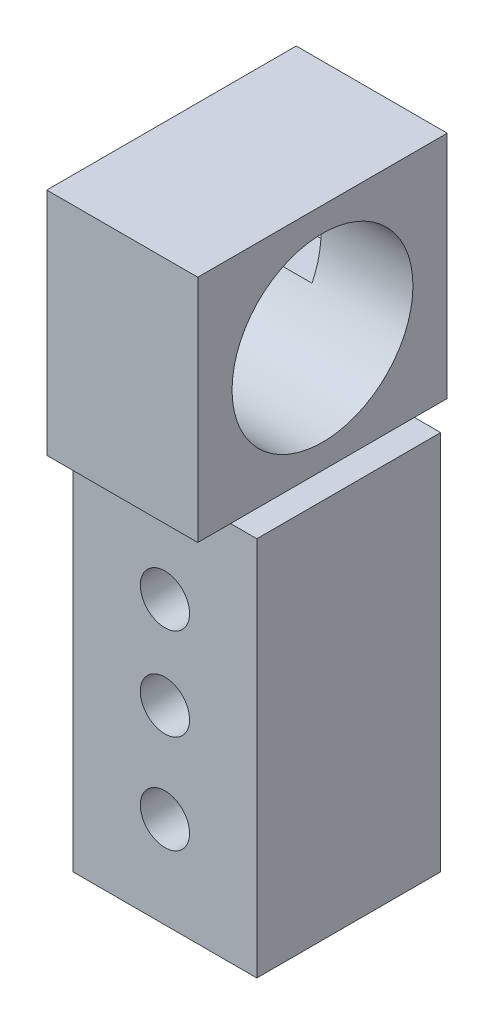
from build123d import *

# Parameters (mm, degrees)
SKETCH1_W           = 35.56
SKETCH1_H           = 35.56
BOSS_EXTRUDE1_DEPTH = 73.5965
SKETCH2_R           = 4.7625
CUT_EXTRUDE1_DEPTH  = 84.648591215
SKETCH3_W           = 25.4
SKETCH3_H           = 35.56
BOSS_EXTRUDE2_DEPTH = 44.45
SKETCH5_W           = 25.4
SKETCH5_H           = 44.45
BOSS_EXTRUDE3_DEPTH = 6.35
SKETCH6_W           = 25.4
SKETCH6_H           = 44.45
BOSS_EXTRUDE4_DEPTH = 6.35
SKETCH4_R           = 17.500000052
CUT_EXTRUDE2_DEPTH  = 84.232998938
SKETCH8_W           = 11.185009969
SKETCH8_H           = 15.24
CUT_EXTRUDE3_DEPTH  = 7.62
SKETCH9_W           = 48.26
SKETCH9_H           = 44.45
BOSS_EXTRUDE6_DEPTH = 3.81
SKETCH12_W          = 8.37609249
SKETCH12_H          = 15.24
CUT_EXTRUDE5_DEPTH  = 3.81
SKETCH13_R          = 5.588
CUT_EXTRUDE6_DEPTH  = 3.81
SKETCH14_R          = 1.5
CUT_EXTRUDE7_DEPTH  = 3.81


with BuildPart() as part:
    # Sketch1 → Boss-Extrude1 (new body)
    with BuildSketch(Plane(origin=(0, 0, 0), x_dir=(1, 0, 0), z_dir=(0, 1, 0))):
        Rectangle(SKETCH1_W, SKETCH1_H)
    extrude(amount=-BOSS_EXTRUDE1_DEPTH)

    # Sketch2 → Cut-Extrude1 (cut, through all)
    with BuildSketch(Plane.XY.offset(17.78)):
        with Locations((0, -19.05)):
            Circle(SKETCH2_R)
        with Locations((0, -36.83)):
            Circle(SKETCH2_R)
        with Locations((0, -55.88)):
            Circle(SKETCH2_R)
    extrude(amount=-CUT_EXTRUDE1_DEPTH, mode=Mode.SUBTRACT)

    # Sketch3 → Boss-Extrude2 (add)
    with BuildSketch(Plane(origin=(0, 0, 0), x_dir=(1, 0, 0), z_dir=(0, 1, 0))):
        Rectangle(SKETCH3_W, SKETCH3_H)
    extrude(amount=BOSS_EXTRUDE2_DEPTH)

    # Sketch5 → Boss-Extrude3 (add)
    with BuildSketch(Plane.XY.offset(17.78)):
        with Locations((0, 22.225)):
            Rectangle(SKETCH5_W, SKETCH5_H)
    extrude(amount=BOSS_EXTRUDE3_DEPTH)

    # Sketch6 → Boss-Extrude4 (add)
    with BuildSketch(Plane(origin=(0, 0, -17.78), x_dir=(-1, 0, 0), z_dir=(0, 0, -1))):
        with Locations((0, 22.225)):
            Rectangle(SKETCH6_W, SKETCH6_H)
    extrude(amount=BOSS_EXTRUDE4_DEPTH)

    # Sketch4 → Cut-Extrude2 (cut, through all)
    with BuildSketch(Plane(origin=(12.7, 0, 0), x_dir=(0, 0, -1), z_dir=(1, 0, 0))):
        with Locations((0, 22.225)):
            Circle(SKETCH4_R)
    extrude(amount=-CUT_EXTRUDE2_DEPTH, mode=Mode.SUBTRACT)

    # Sketch8 → Cut-Extrude3 (cut)
    with BuildSketch(Plane.ZY.offset(12.7)):
        with Locations((-18.537495016, 22.225)):
            Rectangle(SKETCH8_W, SKETCH8_H)
    extrude(amount=-CUT_EXTRUDE3_DEPTH, mode=Mode.SUBTRACT)

    # Sketch9 → Boss-Extrude6 (add)
    with BuildSketch(Plane.ZY.offset(12.7)):
        with Locations((0, 22.225)):
            Rectangle(SKETCH9_W, SKETCH9_H)
    extrude(amount=BOSS_EXTRUDE6_DEPTH)

    # Sketch12 → Cut-Extrude5 (cut)
    with BuildSketch(Plane(origin=(-12.7, 0, 0), x_dir=(0, 0, -1), z_dir=(1, 0, 0))):
        with Locations((19.941953755, 22.225)):
            Rectangle(SKETCH12_W, SKETCH12_H)
    extrude(amount=-CUT_EXTRUDE5_DEPTH, mode=Mode.SUBTRACT)

    # Sketch13 → Cut-Extrude6 (cut)
    with BuildSketch(Plane.ZY.offset(16.51)):
        with Locations((0, 21.902286104)):
            Circle(SKETCH13_R)
    extrude(amount=-CUT_EXTRUDE6_DEPTH, mode=Mode.SUBTRACT)

    # Sketch14 → Cut-Extrude7 (cut)
    with BuildSketch(Plane.ZY.offset(16.51)):
        with Locations((-6.604, 28.956)):
            Circle(SKETCH14_R)
        with Locations((-8.89, 13.462)):
            Circle(SKETCH14_R)
        with Locations((8.89, 30.988)):
            Circle(SKETCH14_R)
        with Locations((6.604, 15.494)):
            Circle(SKETCH14_R)
    extrude(amount=-CUT_EXTRUDE7_DEPTH, mode=Mode.SUBTRACT)


solid = part.part
